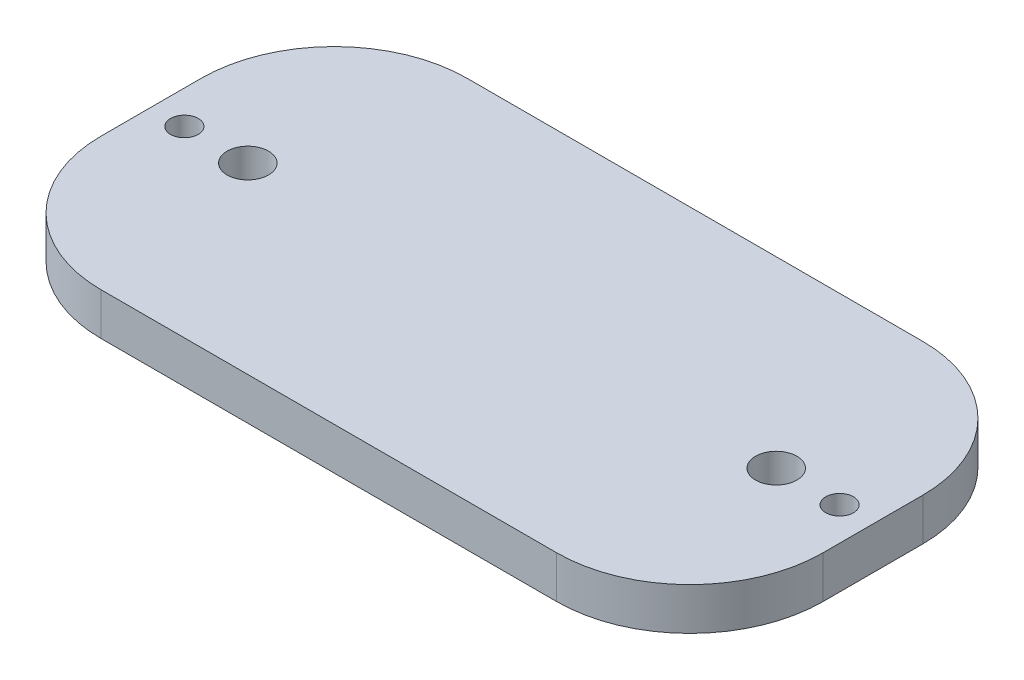
from build123d import *

# Parameters (mm, degrees)
SKETCH1_R           = 2.0828
SKETCH1_R_2         = 3.11
BOSS_EXTRUDE1_DEPTH = 6.35


with BuildPart() as part:
    # Sketch1 → Boss-Extrude1 (new body)
    with BuildSketch(Plane(origin=(0, 0, 0), x_dir=(1, 0, 0), z_dir=(0, 1, 0))):
        with BuildLine():
            Line((-34.2125, -27.5), (34.2125, -27.5))
            ThreePointArc((34.2125, -27.5), (48.354635624, -21.642135624), (54.2125, -7.5))
            Line((54.2125, -7.5), (54.2125, 7.5))
            ThreePointArc((54.2125, 7.5), (48.354635624, 21.642135624), (34.2125, 27.5))
            Line((34.2125, 27.5), (-34.2125, 27.5))
            ThreePointArc((-34.2125, 27.5), (-48.354635624, 21.642135624), (-54.2125, 7.5))
            Line((-54.2125, 7.5), (-54.2125, -7.5))
            ThreePointArc((-54.2125, -7.5), (-48.354635624, -21.642135624), (-34.2125, -27.5))
        make_face()
        with Locations(Location((-49.2125, 0, 0), (0, 0, 270))):
            Circle(SKETCH1_R, mode=Mode.SUBTRACT)
        with Locations(Location((49.2125, 0, 0), (0, 0, 270))):
            Circle(SKETCH1_R, mode=Mode.SUBTRACT)
        with Locations(Location((-39.6875, 0, 0), (0, 0, 270))):
            Circle(SKETCH1_R_2, mode=Mode.SUBTRACT)
        with Locations(Location((39.6875, 0, 0), (0, 0, 270))):
            Circle(SKETCH1_R_2, mode=Mode.SUBTRACT)
    extrude(amount=BOSS_EXTRUDE1_DEPTH)


solid = part.part
